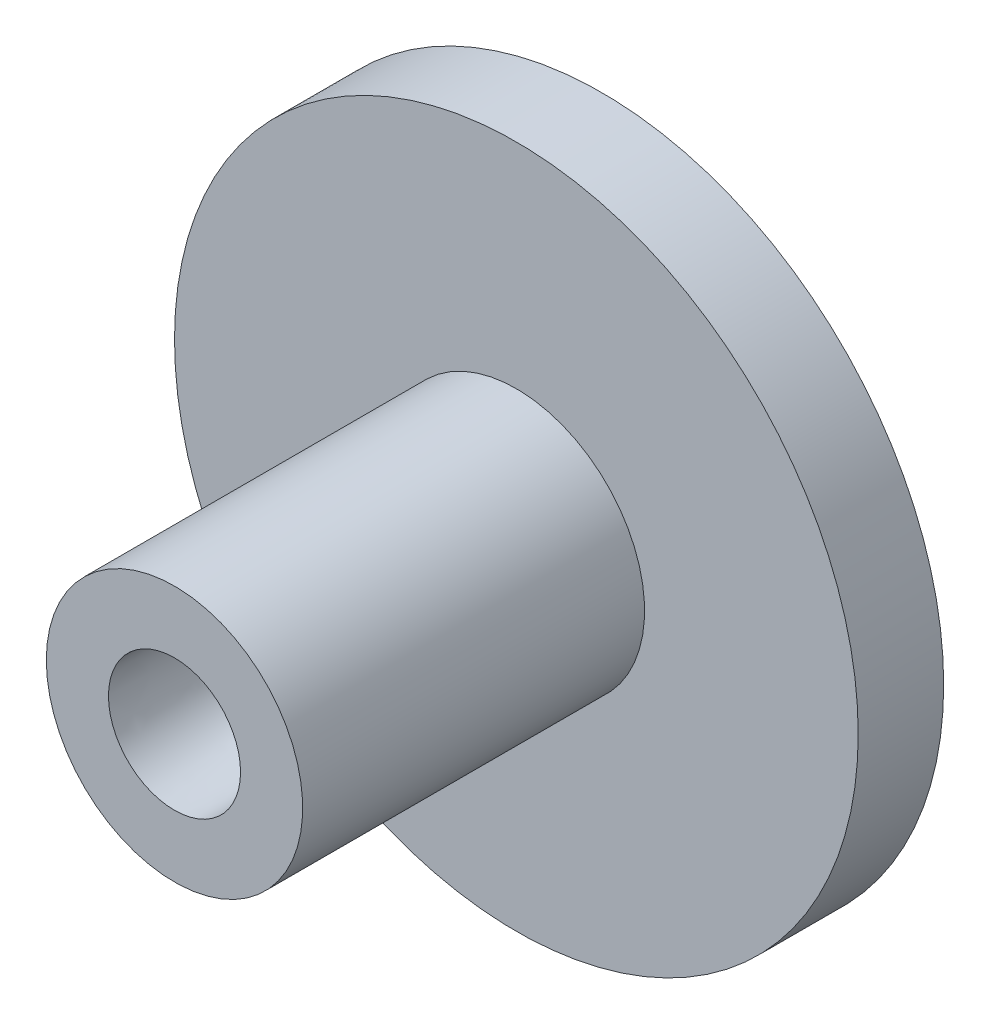
from build123d import *

# Parameters (mm, degrees)
SKETCH1_R           = 20
BOSS_EXTRUDE1_DEPTH = 5


with BuildPart() as part:
    # Sketch1 → Boss-Extrude1 (new body)
    with BuildSketch(Plane.XY):
        Circle(SKETCH1_R)
    extrude(amount=BOSS_EXTRUDE1_DEPTH)

    # Sketch2 → Revolve1 (revolve)
    with BuildSketch(Plane(origin=(0, 0, 0), x_dir=(1, 0, 0), z_dir=(0, 1, 0)), mode=Mode.PRIVATE) as revolve1_sk:
        with BuildLine():
            Line((7.5, -5), (7.5, -25))
            Line((7.5, -25), (3.863319769, -25))
            add(Edge.make_bspline(
                [(3.863319769, -25), (3.668301711, -16.673299189), (2.829585222, -12.90788833), (0, -8.991185618)],
                knots=[0, 0, 0, 0, 1, 1, 1, 1], degree=3))
            Line((0, -8.991185618), (0, -5))
            Line((0, -5), (7.5, -5))
        make_face()
    revolve(revolve1_sk.sketch.rotate(Axis((0, 0, 5), (0, 0, 1)), 180), axis=Axis((0, 0, 5), (0, 0, 1)))


solid = part.part
